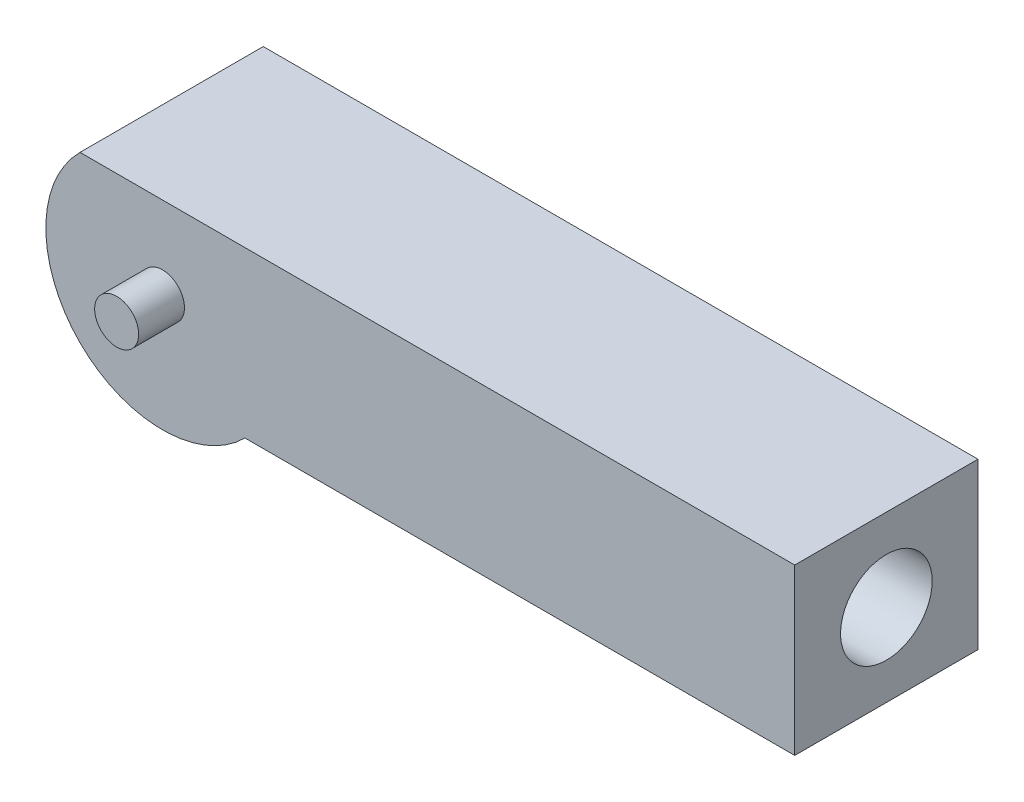
from build123d import *

# Parameters (mm, degrees)
BOSS_EXTRUDE1_DEPTH      = 12.7
BOSS_EXTRUDE2_DEPTH      = 3.175
BOSS_EXTRUDE2_DEPTH_BACK = 15.875
SKETCH3_R                = 1.524
SKETCH2_R                = 3.175
CUT_EXTRUDE1_DEPTH       = 55.869487053


with BuildPart() as part:
    # Sketch1 → Boss-Extrude1 (new body)
    with BuildSketch(Plane.XY):
        with BuildLine():
            Line((5.715, -5.715), (43.815, -5.715))
            Line((43.815, -5.715), (43.815, 5.715))
            Line((43.815, 5.715), (5.715, 5.715))
            Line((5.715, 5.715), (-5.715, 5.715))
            ThreePointArc((-5.715, 5.715), (-5.715, -5.715), (5.715, -5.715))
        make_face()
    extrude(amount=BOSS_EXTRUDE1_DEPTH)

    # Sketch3 → Boss-Extrude2 (add, two sides: drawn at the far end of the back side and taken through both)
    with BuildSketch(Plane.XY.offset(12.7).offset(-BOSS_EXTRUDE2_DEPTH_BACK)):
        Circle(SKETCH3_R)
    extrude(amount=BOSS_EXTRUDE2_DEPTH + BOSS_EXTRUDE2_DEPTH_BACK)

    # Sketch2 → Cut-Extrude1 (cut, through all)
    with BuildSketch(Plane(origin=(43.815, 0, 0), x_dir=(0, 0, -1), z_dir=(1, 0, 0))):
        with Locations((-6.35, 0)):
            Circle(SKETCH2_R)
    extrude(amount=-CUT_EXTRUDE1_DEPTH, mode=Mode.SUBTRACT)


solid = part.part
